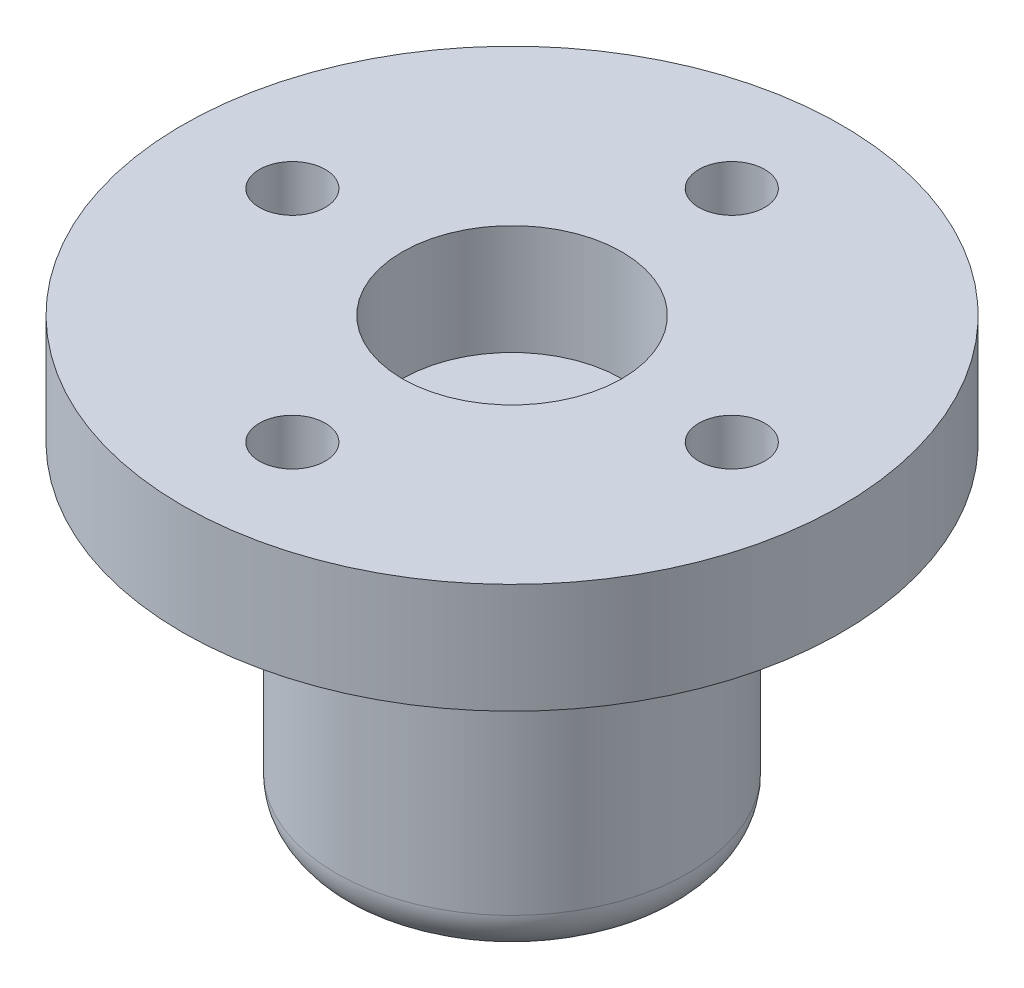
from build123d import *

# Parameters (mm, degrees)
SKETCH2_R           = 19.05
SKETCH2_R_2         = 6.35
SKETCH2_R_3         = 1.905
BOSS_EXTRUDE1_DEPTH = 6.35
SKETCH3_R           = 10.16
BOSS_EXTRUDE2_DEPTH = 19.05
FILLET1_R           = 2.54


with BuildPart() as part:
    # Sketch2 → Boss-Extrude1 (new body)
    with BuildSketch(Plane(origin=(0, 0, 0), x_dir=(1, 0, 0), z_dir=(0, 1, 0))):
        with Locations(Location((0, 0, 0), (0, 0, 270))):
            Circle(SKETCH2_R)
        with Locations(Location((0, 0, 0), (0, 0, 270))):
            Circle(SKETCH2_R_2, mode=Mode.SUBTRACT)
        with Locations(Location((0, 12.7, 0), (0, 0, 270))):
            Circle(SKETCH2_R_3, mode=Mode.SUBTRACT)
        with Locations(Location((12.7, 0, 0), (0, 0, 270))):
            Circle(SKETCH2_R_3, mode=Mode.SUBTRACT)
        with Locations(Location((0, -12.7, 0), (0, 0, 270))):
            Circle(SKETCH2_R_3, mode=Mode.SUBTRACT)
        with Locations(Location((-12.7, 0, 0), (0, 0, 270))):
            Circle(SKETCH2_R_3, mode=Mode.SUBTRACT)
    extrude(amount=-BOSS_EXTRUDE1_DEPTH)

    # Sketch3 → Boss-Extrude2 (add)
    with BuildSketch(Plane.XZ.offset(6.35)):
        with Locations(Location((0, 0, 0), (0, 0, 90))):
            Circle(SKETCH3_R)
    extrude(amount=BOSS_EXTRUDE2_DEPTH)

    # Fillet1
    fillet1_edges = [part.edges().sort_by_distance(p)[0] for p in [
        (0, -25.4, -10.16),
    ]]
    fillet(fillet1_edges, radius=FILLET1_R)


with BuildPart() as body_2:
    # Sketch5 → Revolve1 (revolve)
    with BuildSketch(Plane.XZ.offset(25.4)):
        with BuildLine():
            Line((0, 7.62), (0, -7.62))
            ThreePointArc((0, -7.62), (7.62, 0), (0, 7.62))
        make_face()
    revolve(axis=Axis((0, -25.4, -11.766022755), (0, 0, 1)))


with BuildPart() as part_1:
    add(part.part)

    # Combine1: cut body 2
    add(body_2.part, mode=Mode.SUBTRACT)


solid = part_1.part
